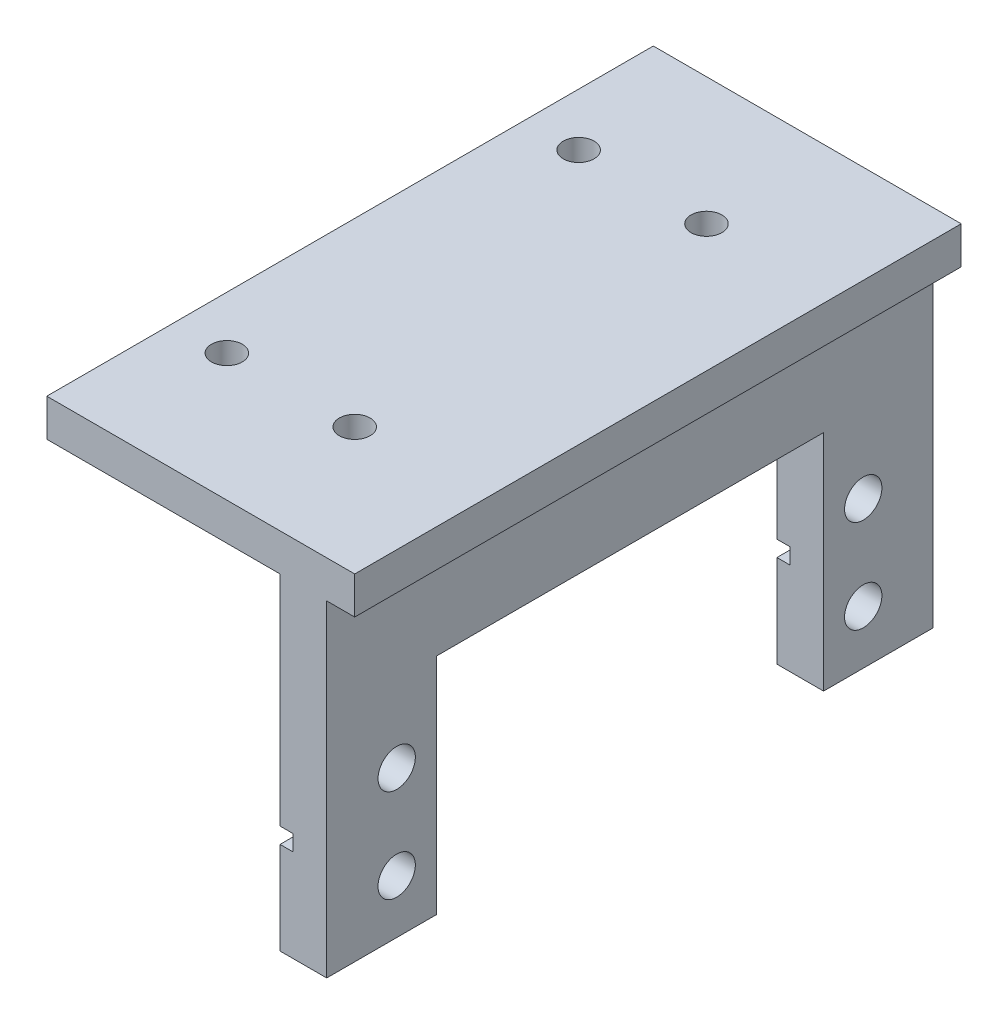
from build123d import *

# Parameters (mm, degrees)
EXTRUDE_3_DEPTH      = 5
EXTRUDE_4_DEPTH      = 25
EXTRUDE_4_DEPTH_BACK = 8
SKETCH_4_W           = 65
SKETCH_4_H           = 4
CUT_EXTRUDE_START    = -65
SKETCH_5_W           = 1.4
SKETCH_5_H           = 1.7
CUT_EXTRUDE_1_DEPTH  = 65
SKETCH_6_R           = 2
CUT_EXTRUDE_2_DEPTH  = 5
SKETCH_7_R           = 1.65
CUT_EXTRUDE_3_DEPTH  = 4


with BuildPart() as part:
    # 草图2 → 凸台-拉伸3 (new body)
    with BuildSketch(Plane(origin=(0, 0, 0), x_dir=(0, 0, -1), z_dir=(1, 0, 0))):
        Polygon((32.5, -19.5), (20.75, -19.5), (20.75, 4.5), (-20.75, 4.5), (-20.75, -19.5), (-32.5, -19.5), (-32.5, 19.5), (32.5, 19.5), align=None)
    extrude(amount=EXTRUDE_3_DEPTH)

    # 草图4 → 凸台-拉伸4 (add, two sides: drawn at the far end of the back side and taken through both)
    with BuildSketch(Plane.ZY.offset(-EXTRUDE_4_DEPTH_BACK)):
        with Locations((0, 17.5)):
            Rectangle(SKETCH_4_W, SKETCH_4_H)
    extrude(amount=EXTRUDE_4_DEPTH + EXTRUDE_4_DEPTH_BACK)

    # 草图5 → 切除-拉伸1 (cut)
    with BuildSketch(Plane.XY.offset(32.5).offset(CUT_EXTRUDE_START)):
        with Locations((0.7, -8.75)):
            Rectangle(SKETCH_5_W, SKETCH_5_H)
    extrude(amount=CUT_EXTRUDE_1_DEPTH, mode=Mode.SUBTRACT)

    # 草图6 → 切除-拉伸2 (cut)
    with BuildSketch(Plane(origin=(5, 0, 0), x_dir=(0, 0, -1), z_dir=(1, 0, 0))):
        with Locations((-25, -3.75)):
            Circle(SKETCH_6_R)
        with Locations((-25, -13.75)):
            Circle(SKETCH_6_R)
        with Locations(Location((25, -13.75, 0), (0, 0, 180))):
            Circle(SKETCH_6_R)
        with Locations(Location((25, -3.75, 0), (0, 0, 180))):
            Circle(SKETCH_6_R)
    extrude(amount=-CUT_EXTRUDE_2_DEPTH, mode=Mode.SUBTRACT)

    # 草图7 → 切除-拉伸3 (cut)
    with BuildSketch(Plane(origin=(0, 19.5, 0), x_dir=(1, 0, 0), z_dir=(0, 1, 0))):
        with Locations(Location((-19.35, -18.85, 0), (0, 0, 270))):
            Circle(SKETCH_7_R)
        with Locations(Location((-5.65, -18.85, 0), (0, 0, 270))):
            Circle(SKETCH_7_R)
        with Locations(Location((-19.35, 18.85, 0), (0, 0, 270))):
            Circle(SKETCH_7_R)
        with Locations(Location((-5.65, 18.85, 0), (0, 0, 270))):
            Circle(SKETCH_7_R)
    extrude(amount=-CUT_EXTRUDE_3_DEPTH, mode=Mode.SUBTRACT)


solid = part.part
